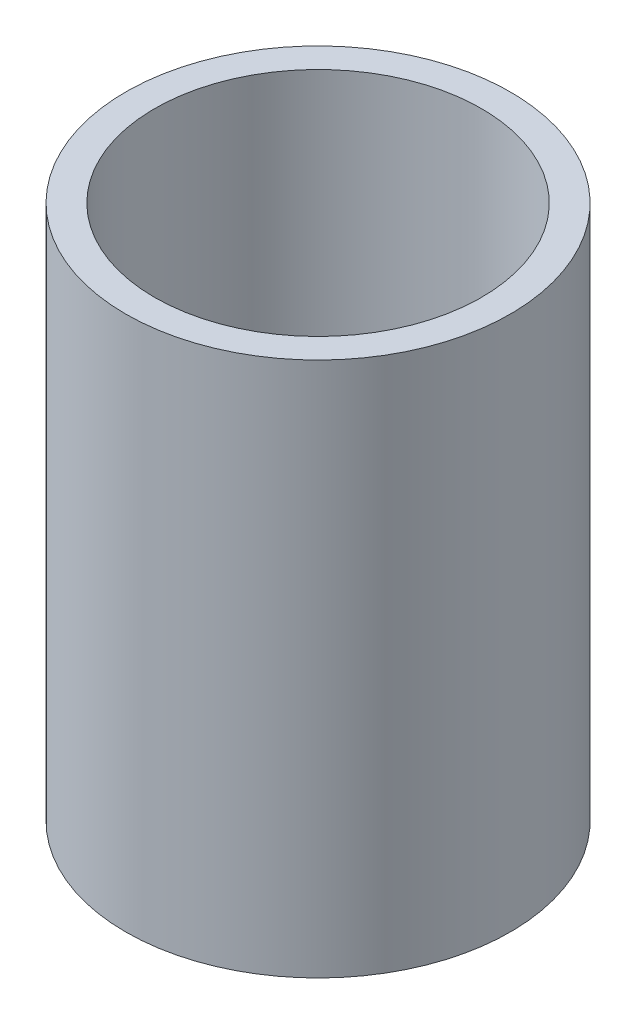
from build123d import *

# Parameters (mm, degrees)
SKETCH_1_R          = 30
EXTRUDE_1_DEPTH     = 83.46
SKETCH_2_R          = 25.5
CUT_EXTRUDE_1_DEPTH = 83.46


with BuildPart() as part:
    # 스케치1 → 보스-돌출1 (new body)
    with BuildSketch(Plane(origin=(0, 0, 0), x_dir=(1, 0, 0), z_dir=(0, 1, 0))):
        with Locations(Location((0, 0, 0), (0, 0, 270))):
            Circle(SKETCH_1_R)
    extrude(amount=-EXTRUDE_1_DEPTH)

    # 스케치2 → 컷-돌출1 (cut)
    with BuildSketch(Plane(origin=(0, 0, 0), x_dir=(1, 0, 0), z_dir=(0, 1, 0))):
        with Locations(Location((0, 0, 0), (0, 0, 270))):
            Circle(SKETCH_2_R)
    extrude(amount=-CUT_EXTRUDE_1_DEPTH, mode=Mode.SUBTRACT)


solid = part.part
